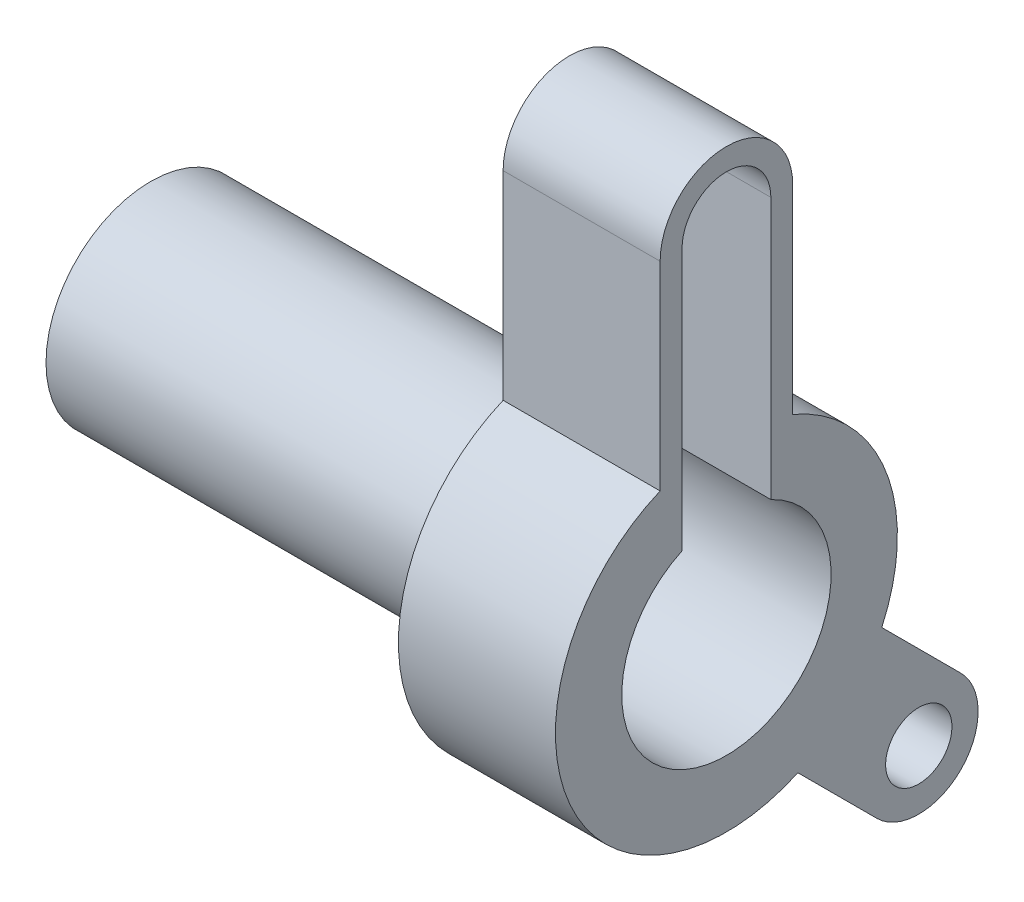
from build123d import *

# Parameters (mm, degrees)
SKETCH_1_W          = 120
SKETCH_1_H          = 20
SKETCH_1_W_2        = 45
SKETCH_1_H_2        = 19
SKETCH_2_R          = 9.5
EXTRUDE_1_DEPTH     = 45
CUT_EXTRUDE_1_DEPTH = 218.043995612


with BuildPart() as part:
    # Эскиз1 → Повернуть1 (revolve)
    with BuildSketch(Plane.XY, mode=Mode.PRIVATE) as revolve_1_sk:
        with Locations((60, -20)):
            Rectangle(SKETCH_1_W, SKETCH_1_H)
        with Locations((142.5, -39.5)):
            Rectangle(SKETCH_1_W_2, SKETCH_1_H_2)
    revolve(revolve_1_sk.sketch.rotate(Axis((0, 0, 0), (1, 0, 0)), 270), axis=Axis((0, 0, 0), (1, 0, 0)))

    # Эскиз2 → Бобышка-Вытянуть1 (add)
    # profile 1 of 2: a face of its own
    with BuildSketch(Plane(origin=(165, 0, 0), x_dir=(0, 0, -1), z_dir=(1, 0, 0))):
        with BuildLine():
            Line((-19, 102.166359163), (-19, 45.166359163))
            ThreePointArc((-19, 45.166359163), (-15.900187239, 46.348506403), (-12.727487177, 47.318189633))
            Line((-12.727487177, 47.318189633), (-12.727487177, 102.166359163))
            ThreePointArc((-12.727487177, 102.166359163), (0, 114.89384634), (12.727487177, 102.166359163))
            Line((12.727487177, 102.166359163), (12.727487177, 47.318189633))
            ThreePointArc((12.727487177, 47.318189633), (15.900187239, 46.348506403), (19, 45.166359163))
            Line((19, 45.166359163), (19, 102.166359163))
            ThreePointArc((19, 102.166359163), (0, 121.166359163), (-19, 102.166359163))
        make_face()
    # profile 2 of 2: a face of its own
    with BuildSketch(Plane(origin=(165, 0, 0), x_dir=(0, 0, -1), z_dir=(1, 0, 0))):
        with BuildLine():
            ThreePointArc((44.516968899, -20.475338338), (34.648232278, -34.648232278), (20.475338338, -44.516968899))
            Line((20.475338338, -44.516968899), (43.102755336, -67.144385897))
            ThreePointArc((43.102755336, -67.144385897), (67.144385897, -67.144385897), (67.144385897, -43.102755336))
            Line((67.144385897, -43.102755336), (44.516968899, -20.475338338))
        make_face()
        with Locations((55.123570617, -55.123570617)):
            Circle(SKETCH_2_R, mode=Mode.SUBTRACT)
    extrude(amount=-EXTRUDE_1_DEPTH)

    # Эскиз2<4> → Вырез-Вытянуть1 (cut, through all)
    with BuildSketch(Plane(origin=(165, 0, 0), x_dir=(0, 0, -1), z_dir=(1, 0, 0))):
        with BuildLine():
            ThreePointArc((12.727487177, 47.318189633), (0, 49), (-12.727487177, 47.318189633))
            Line((-12.727487177, 47.318189633), (-12.727487177, 27.166359163))
            ThreePointArc((-12.727487177, 27.166359163), (0, 30), (12.727487177, 27.166359163))
            Line((12.727487177, 27.166359163), (12.727487177, 47.318189633))
        make_face()
    extrude(amount=-CUT_EXTRUDE_1_DEPTH, mode=Mode.SUBTRACT)


solid = part.part
